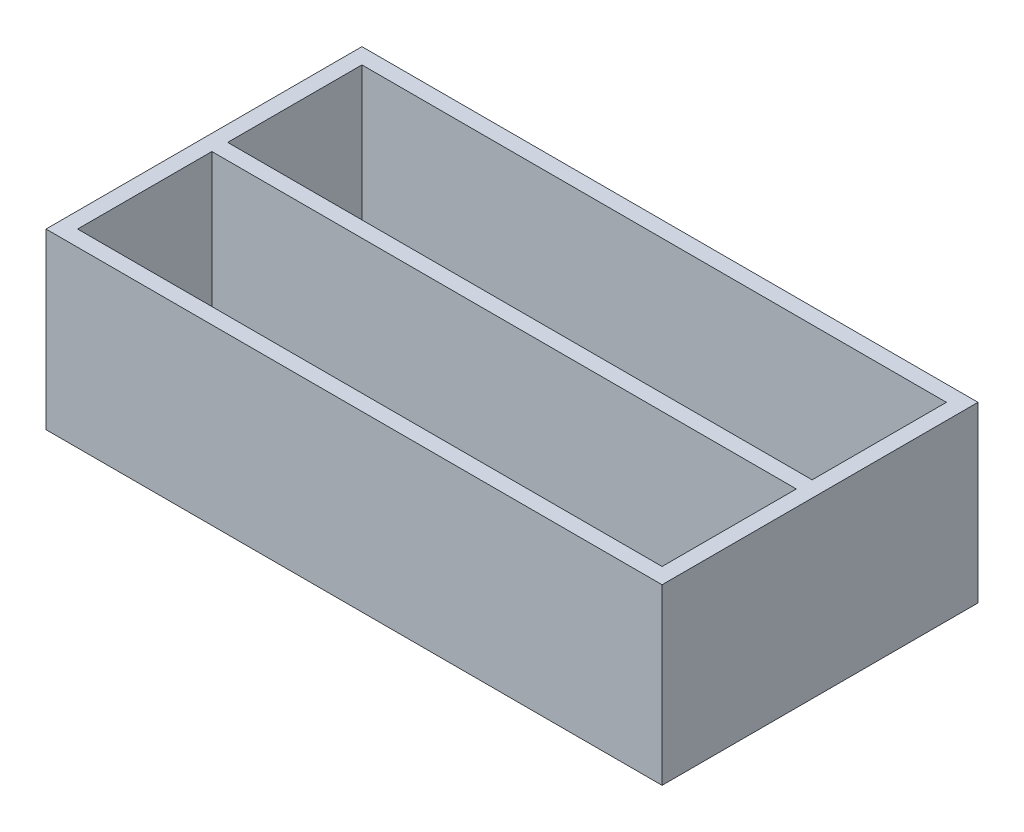
from build123d import *

# Parameters (mm, degrees)
SKETCH1_W           = 78
SKETCH1_H           = 40
BOSS_EXTRUDE1_DEPTH = 22
SKETCH2_W           = 74
SKETCH2_H           = 17
CUT_EXTRUDE1_DEPTH  = 20


with BuildPart() as part:
    # Sketch1 → Boss-Extrude1 (new body)
    with BuildSketch(Plane(origin=(0, 0, 0), x_dir=(1, 0, 0), z_dir=(0, 1, 0))):
        with Locations((-39, 20)):
            Rectangle(SKETCH1_W, SKETCH1_H)
    extrude(amount=BOSS_EXTRUDE1_DEPTH)

    # Sketch2 → Cut-Extrude1 (cut)
    with BuildSketch(Plane(origin=(0, 22, 0), x_dir=(1, 0, 0), z_dir=(0, 1, 0))):
        with Locations((-39, 29.5)):
            Rectangle(SKETCH2_W, SKETCH2_H)
        with Locations((-39, 10.5)):
            Rectangle(SKETCH2_W, SKETCH2_H)
    extrude(amount=-CUT_EXTRUDE1_DEPTH, mode=Mode.SUBTRACT)


solid = part.part
